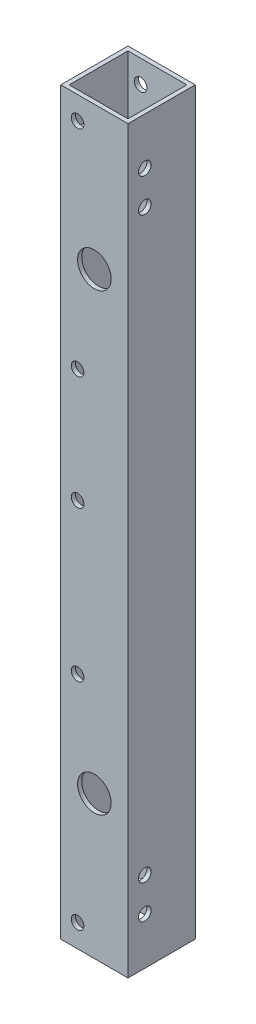
from build123d import *

# Parameters (mm, degrees)
SKETCH1_W                      = 25.4
SKETCH1_H                      = 279.4
BOSS_EXTRUDE1_DEPTH            = 25.4
SKETCH2_W                      = 22.225
SKETCH2_H                      = 22.225
CUT_EXTRUDE1_DEPTH             = 279.4
SKETCH3_R                      = 6.35
CUT_EXTRUDE2_DEPTH             = 25.4
F_3_16_0_1875_DIAMETER_HOLE2_D = 4.7625
F_3_16_0_1875_DIAMETER_HOLE3_D = 4.7625


with BuildPart() as part:
    # Sketch1 → Boss-Extrude1 (new body)
    with BuildSketch(Plane.XY):
        with Locations((76.086049872, -37.64964539)):
            Rectangle(SKETCH1_W, SKETCH1_H)
    extrude(amount=BOSS_EXTRUDE1_DEPTH)

    # Sketch2 → Cut-Extrude1 (cut)
    with BuildSketch(Plane(origin=(0, 102.05035461, 0), x_dir=(1, 0, 0), z_dir=(0, 1, 0))):
        with Locations((76.086049872, -12.7)):
            Rectangle(SKETCH2_W, SKETCH2_H)
    extrude(amount=-CUT_EXTRUDE1_DEPTH, mode=Mode.SUBTRACT)

    # Sketch3 → Cut-Extrude2 (cut)
    with BuildSketch(Plane(origin=(0, 0, 0), x_dir=(-1, 0, 0), z_dir=(0, 0, -1))):
        with Locations((-76.086049872, 48.07535461)):
            Circle(SKETCH3_R)
        with Locations((-76.086049872, -123.37464539)):
            Circle(SKETCH3_R)
    extrude(amount=-CUT_EXTRUDE2_DEPTH, mode=Mode.SUBTRACT)

    # 3/16 (0.1875) Diameter Hole2 (through all)
    with Locations(Plane(origin=(0, 0, 0), x_dir=(-1, 0, 0), z_dir=(0, 0, -1))):
        with Locations((-69.736049872, 93.41435461), (-69.736049872, 12.26135461), (-69.736049872, -30.66464539), (-69.736049872, -87.43364539), (-69.736049872, -168.71364539)):
            Hole(F_3_16_0_1875_DIAMETER_HOLE2_D / 2)

    # 3/16 (0.1875) Diameter Hole3 (through all)
    with Locations(Plane(origin=(88.786049872, 0, 0), x_dir=(0, 0, -1), z_dir=(1, 0, 0))):
        with Locations((-19.05, -159.56964539), (-19.05, -146.86964539), (-19.05, 71.57035461), (-19.05, 84.27035461)):
            Hole(F_3_16_0_1875_DIAMETER_HOLE3_D / 2)


solid = part.part
